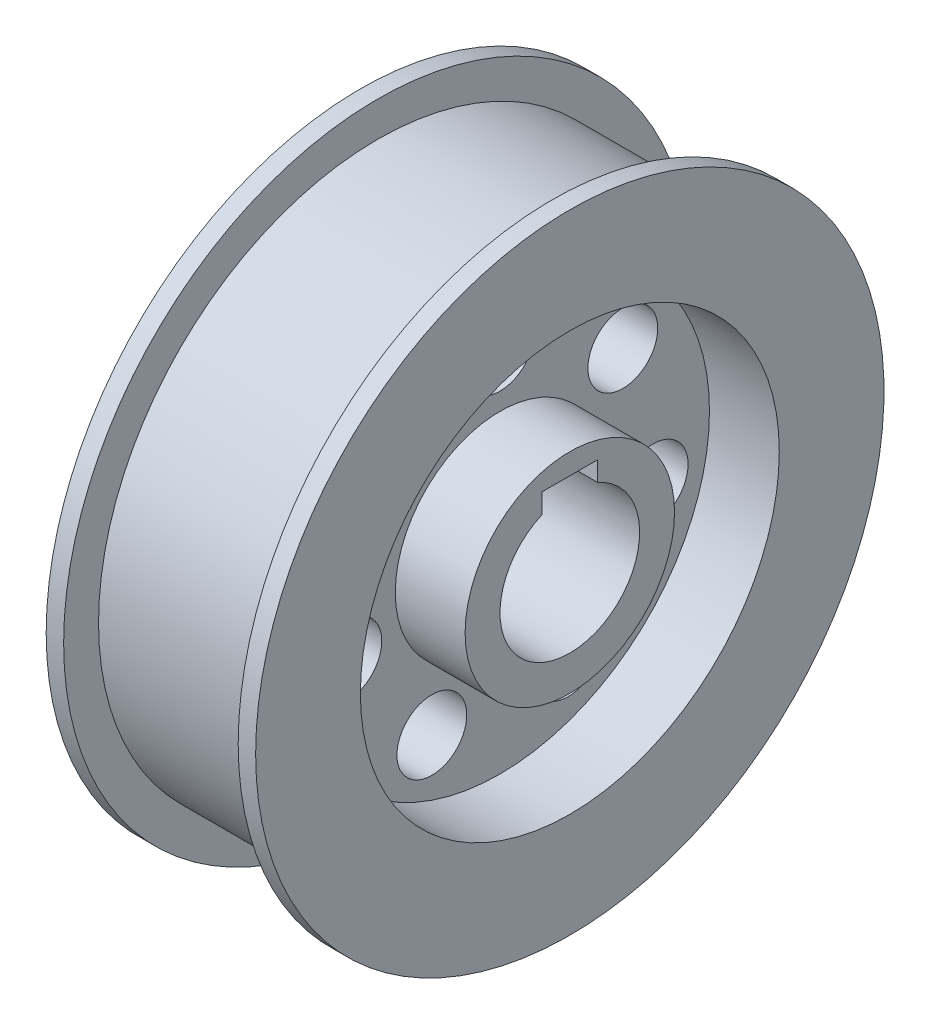
from build123d import *

# Parameters (mm, degrees)
BOSS_EXTRUDE1_DEPTH      = 15
BOSS_EXTRUDE1_DEPTH_BACK = 15
SKETCH1_R                = 15
SKETCH2_R                = 13
SKETCH2_R_2              = 3.5
BOSS_EXTRUDE2_DEPTH      = 5
BOSS_EXTRUDE3_DEPTH      = 5
BOSS_EXTRUDE3_DEPTH_BACK = 5
SKETCH3_R                = 30
SKETCH3_R_2              = 5
SKETCH3_R_3              = 13.5
BOSS_EXTRUDE4_DEPTH      = 15
BOSS_EXTRUDE4_DEPTH_BACK = 15
SKETCH4_R                = 40
SKETCH4_R_2              = 30


with BuildPart() as part:
    # Sketch1 → Boss-Extrude1 (new, two sides: drawn at the far end of the back side and taken through both)
    with BuildSketch(Plane(origin=(0, 0, 0), x_dir=(0, 0, -1), z_dir=(1, 0, 0)).offset(-BOSS_EXTRUDE1_DEPTH_BACK)):
        Circle(SKETCH1_R)
        with BuildLine():
            Line((-4, 9.16515139), (-4, 12))
            Line((-4, 12), (4, 12))
            Line((4, 12), (4, 9.16515139))
            ThreePointArc((4, 9.16515139), (0, -10), (-4, 9.16515139))
        make_face(mode=Mode.SUBTRACT)
    extrude(amount=BOSS_EXTRUDE1_DEPTH + BOSS_EXTRUDE1_DEPTH_BACK)

    # Sketch2 → Boss-Extrude2 (add)
    with BuildSketch(Plane.ZY.offset(15)):
        Circle(SKETCH2_R)
        Circle(SKETCH2_R_2, mode=Mode.SUBTRACT)
    extrude(amount=-BOSS_EXTRUDE2_DEPTH)

    # Sketch3 → Boss-Extrude3 (add, two sides: drawn at the far end of the back side and taken through both)
    with BuildSketch(Plane(origin=(0, 0, 0), x_dir=(0, 0, -1), z_dir=(1, 0, 0)).offset(-BOSS_EXTRUDE3_DEPTH_BACK)):
        Circle(SKETCH3_R)
        with Locations((0, 22.5)):
            Circle(SKETCH3_R_2, mode=Mode.SUBTRACT)
        with Locations((17.591208356, 14.028520542)):
            Circle(SKETCH3_R_2, mode=Mode.SUBTRACT)
        with Locations((21.935878024, -5.006721014)):
            Circle(SKETCH3_R_2, mode=Mode.SUBTRACT)
        with Locations((9.76238413, -20.271799528)):
            Circle(SKETCH3_R_2, mode=Mode.SUBTRACT)
        with Locations((-9.76238413, -20.271799528)):
            Circle(SKETCH3_R_2, mode=Mode.SUBTRACT)
        with Locations((-21.935878024, -5.006721014)):
            Circle(SKETCH3_R_2, mode=Mode.SUBTRACT)
        with Locations((-17.591208356, 14.028520542)):
            Circle(SKETCH3_R_2, mode=Mode.SUBTRACT)
        Circle(SKETCH3_R_3, mode=Mode.SUBTRACT)
    extrude(amount=BOSS_EXTRUDE3_DEPTH + BOSS_EXTRUDE3_DEPTH_BACK)

    # Sketch4 → Boss-Extrude4 (add, two sides: drawn at the far end of the back side and taken through both)
    with BuildSketch(Plane(origin=(0, 0, 0), x_dir=(0, 0, -1), z_dir=(1, 0, 0)).offset(-BOSS_EXTRUDE4_DEPTH_BACK)):
        Circle(SKETCH4_R)
        Circle(SKETCH4_R_2, mode=Mode.SUBTRACT)
    extrude(amount=BOSS_EXTRUDE4_DEPTH + BOSS_EXTRUDE4_DEPTH_BACK)

    # Sketch5 → Revolve1 (revolve)
    with BuildSketch(Plane.XY):
        Polygon((-15, 36), (-15, 45), (-12.5, 45), (-12.5, 37), (12.5, 37), (12.5, 45), (15, 45), (15, 36), align=None)
    revolve(axis=Axis((0, 0, 0), (1, 0, 0)))


solid = part.part
